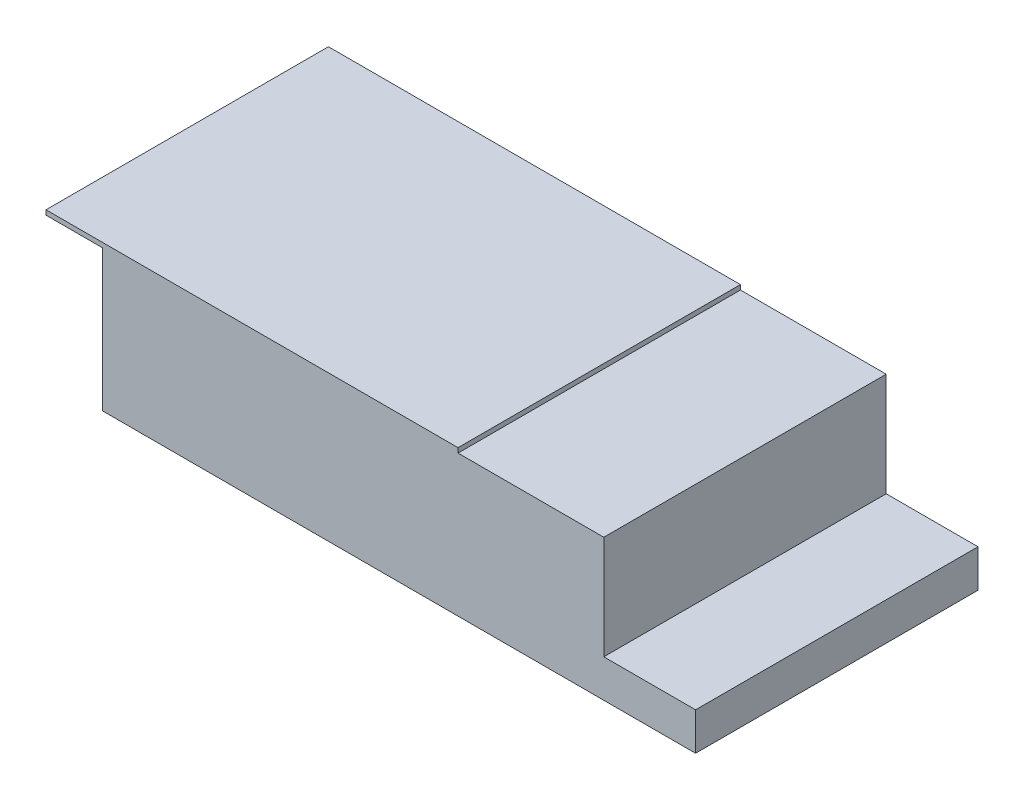
from build123d import *

# Parameters (mm, degrees)
SKETCH1_W           = 126
SKETCH1_H           = 60
BOSS_EXTRUDE1_DEPTH = 30
SKETCH2_W           = 19.5
SKETCH2_H           = 60
CUT_EXTRUDE1_DEPTH  = 22
SKETCH3_W           = 87.533281477
SKETCH3_H           = 60
BOSS_EXTRUDE2_DEPTH = 1


with BuildPart() as part:
    # Sketch1 → Boss-Extrude1 (new body)
    with BuildSketch(Plane(origin=(0, 0, 0), x_dir=(1, 0, 0), z_dir=(0, 1, 0))):
        Rectangle(SKETCH1_W, SKETCH1_H)
    extrude(amount=BOSS_EXTRUDE1_DEPTH)

    # Sketch2 → Cut-Extrude1 (cut)
    with BuildSketch(Plane(origin=(0, 30, 0), x_dir=(1, 0, 0), z_dir=(0, 1, 0))):
        with Locations((53.25, 0)):
            Rectangle(SKETCH2_W, SKETCH2_H)
    extrude(amount=-CUT_EXTRUDE1_DEPTH, mode=Mode.SUBTRACT)

    # Sketch3 → Boss-Extrude2 (add)
    with BuildSketch(Plane(origin=(0, 30, 0), x_dir=(1, 0, 0), z_dir=(0, 1, 0))):
        with Locations((-31.233359261, 0)):
            Rectangle(SKETCH3_W, SKETCH3_H)
    extrude(amount=BOSS_EXTRUDE2_DEPTH)


solid = part.part
